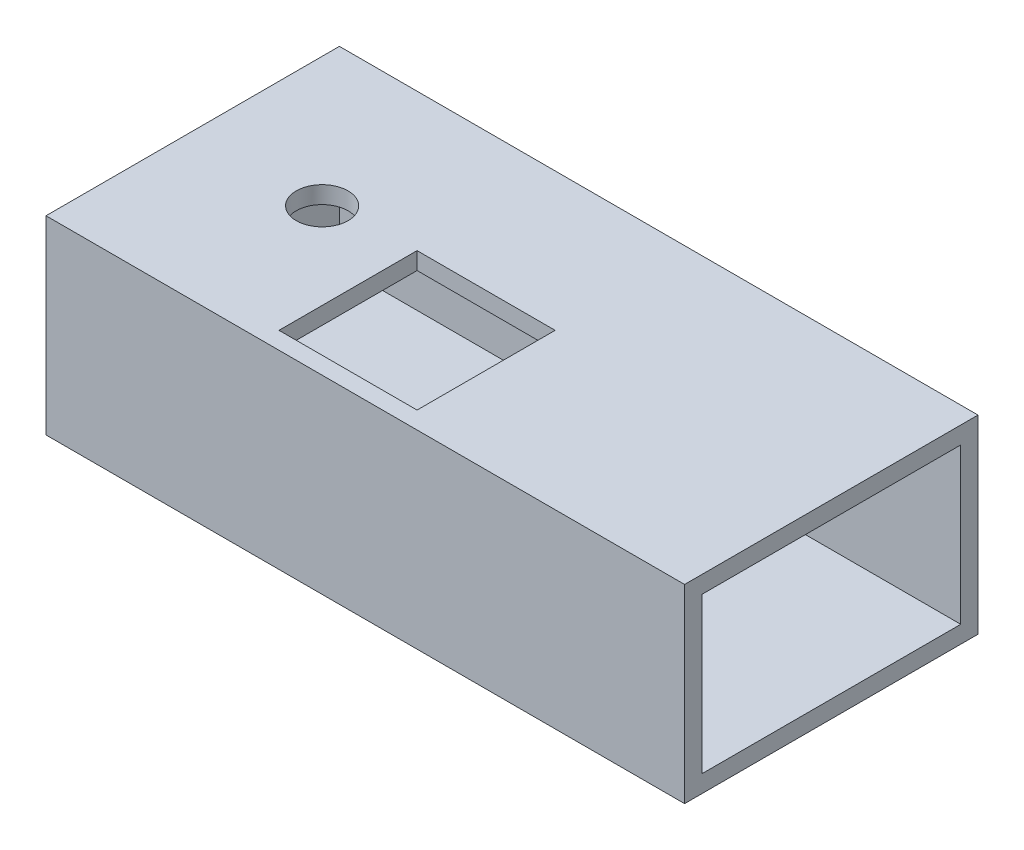
from build123d import *

# Parameters (mm, degrees)
SKETCH1_W           = 37
SKETCH1_H           = 17
BOSS_EXTRUDE1_DEPTH = 11
SHELL1_T            = -1
SKETCH2_W           = 10
SKETCH2_H           = 3.5
CUT_EXTRUDE1_DEPTH  = 11
SKETCH3_R           = 1.5
SKETCH3_W           = 8
SKETCH3_H           = 8
CUT_EXTRUDE2_DEPTH  = 2


with BuildPart() as part:
    # Sketch1 → Boss-Extrude1 (new body)
    with BuildSketch(Plane(origin=(0, 0, 0), x_dir=(1, 0, 0), z_dir=(0, 1, 0))):
        Rectangle(SKETCH1_W, SKETCH1_H)
    extrude(amount=BOSS_EXTRUDE1_DEPTH)

    # Shell1
    shell1_openings = [part.faces().sort_by_distance(p)[0] for p in [
        (18.5, 5.5, 0),
    ]]
    offset(amount=SHELL1_T, openings=shell1_openings, kind=Kind.INTERSECTION)

    # Sketch2 → Cut-Extrude1 (cut)
    with BuildSketch(Plane.ZY.offset(18.5)):
        with Locations((0, 7.75)):
            Rectangle(SKETCH2_W, SKETCH2_H)
    extrude(amount=-CUT_EXTRUDE1_DEPTH, mode=Mode.SUBTRACT)

    # Sketch3 → Cut-Extrude2 (cut)
    with BuildSketch(Plane(origin=(0, 11, 0), x_dir=(1, 0, 0), z_dir=(0, 1, 0))):
        with Locations(Location((-11, 0, 0), (0, 0, 270))):
            Circle(SKETCH3_R)
        with Locations((-2, -3.5)):
            Rectangle(SKETCH3_W, SKETCH3_H)
    extrude(amount=-CUT_EXTRUDE2_DEPTH, mode=Mode.SUBTRACT)


solid = part.part
